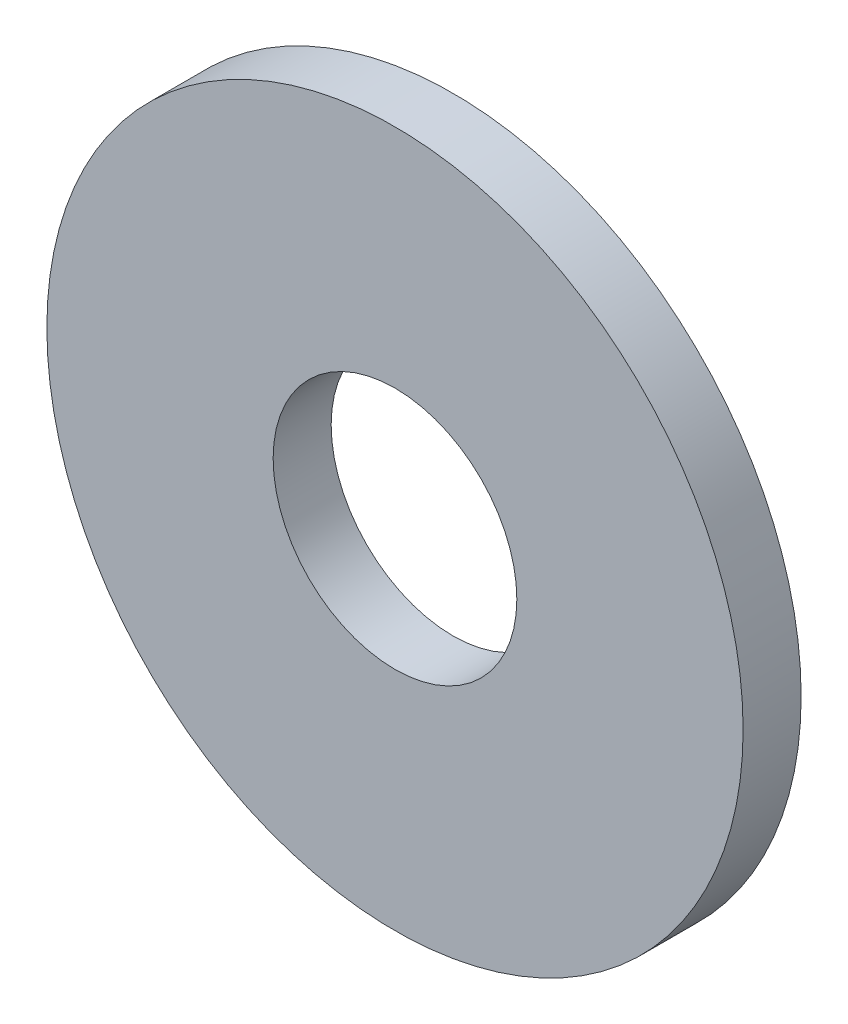
from build123d import *

# Parameters (mm, degrees)
SKETCH_1_R      = 12
SKETCH_1_R_2    = 4.2
EXTRUDE_1_DEPTH = 2


with BuildPart() as part:
    # Эскиз1 → Бобышка-Вытянуть1 (new body)
    with BuildSketch(Plane.XY):
        Circle(SKETCH_1_R)
        Circle(SKETCH_1_R_2, mode=Mode.SUBTRACT)
    extrude(amount=EXTRUDE_1_DEPTH)


solid = part.part
